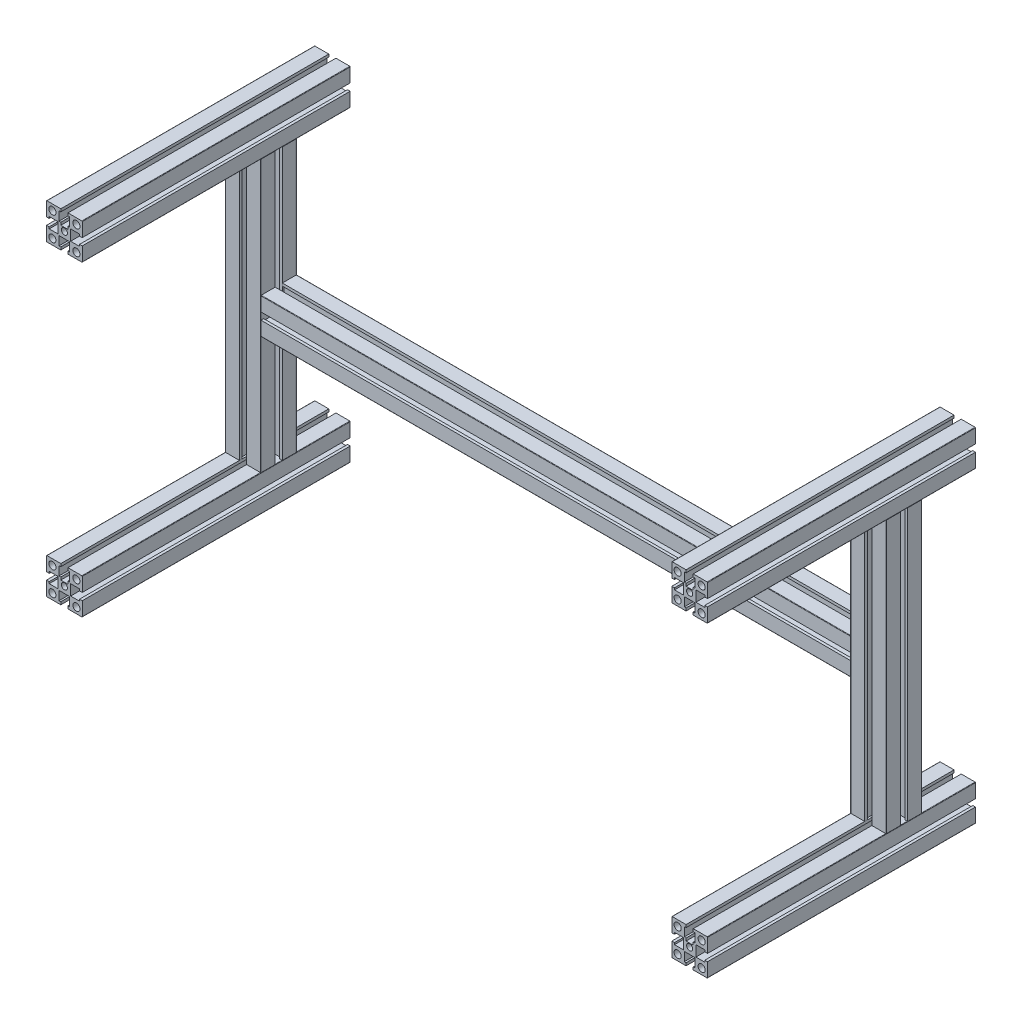
from build123d import *

# Parameters (mm, degrees)
SKETCH1_R                    = 3.4
SKETCH1_R_2                  = 4
F_40_X_40GF_X_R0_5_1_DEPTH   = 300
SKETCH1_ON_SEGMENT_2_R       = 3.4
SKETCH1_ON_SEGMENT_2_R_2     = 4
F_40_X_40GF_X_R0_5_1_2_DEPTH = 300
SKETCH1_ON_SEGMENT_3_R       = 3.4
SKETCH1_ON_SEGMENT_3_R_2     = 4
F_40_X_40GF_X_R0_5_1_3_DEPTH = 300
SKETCH1_ON_SEGMENT_4_R       = 3.4
SKETCH1_ON_SEGMENT_4_R_2     = 4
F_40_X_40GF_X_R0_5_1_4_DEPTH = 300
SKETCH1_ON_SEGMENT_5_R       = 3.4
SKETCH1_ON_SEGMENT_5_R_2     = 4
F_40_X_40GF_X_R0_5_1_5_DEPTH = 346
SKETCH1_ON_SEGMENT_6_R       = 3.4
SKETCH1_ON_SEGMENT_6_R_2     = 4
F_40_X_40GF_X_R0_5_1_6_DEPTH = 346
SKETCH1_ON_SEGMENT_7_R       = 3.4
SKETCH1_ON_SEGMENT_7_R_2     = 4
F_40_X_40GF_X_R0_5_1_7_DEPTH = 702


with BuildPart() as part:
    # Sketch1 → 工业铝型材 40 X 40GF X R0.5(1) (new body)
    with BuildSketch(Plane(origin=(-350, -172, 0), x_dir=(1, 0, 0), z_dir=(0, 0, 1))):
        with BuildLine():
            Line((-19.5, 20), (-4, 20))
            Line((-4, 20), (-4, 17))
            Line((-4, 17), (-6, 17))
            Line((-6, 17), (-6, 7))
            Line((-6, 7), (-4, 7))
            Line((-4, 7), (-4, 4))
            Line((-4, 4), (4, 4))
            Line((4, 4), (4, 7))
            Line((4, 7), (6, 7))
            Line((6, 7), (6, 17))
            Line((6, 17), (4, 17))
            Line((4, 17), (4, 20))
            Line((4, 20), (19.5, 20))
            ThreePointArc((19.5, 20), (19.853553391, 19.853553391), (20, 19.5))
            Line((20, 19.5), (20, 4))
            Line((20, 4), (17, 4))
            Line((17, 4), (17, 6))
            Line((17, 6), (7, 6))
            Line((7, 6), (7, -6))
            Line((7, -6), (17, -6))
            Line((17, -6), (17, -4))
            Line((17, -4), (20, -4))
            Line((20, -4), (20, -19.5))
            ThreePointArc((20, -19.5), (19.853553391, -19.853553391), (19.5, -20))
            Line((19.5, -20), (4, -20))
            Line((4, -20), (4, -17))
            Line((4, -17), (6, -17))
            Line((6, -17), (6, -7))
            Line((6, -7), (-6, -7))
            Line((-6, -7), (-6, -17))
            Line((-6, -17), (-4, -17))
            Line((-4, -17), (-4, -20))
            Line((-4, -20), (-19.5, -20))
            ThreePointArc((-19.5, -20), (-19.853553391, -19.853553391), (-20, -19.5))
            Line((-20, -19.5), (-20, -4))
            Line((-20, -4), (-17, -4))
            Line((-17, -4), (-17, -6))
            Line((-17, -6), (-7, -6))
            Line((-7, -6), (-7, 6))
            Line((-7, 6), (-17, 6))
            Line((-17, 6), (-17, 4))
            Line((-17, 4), (-20, 4))
            Line((-20, 4), (-20, 19.5))
            ThreePointArc((-20, 19.5), (-19.853553391, 19.853553391), (-19.5, 20))
        make_face()
        Circle(SKETCH1_R, mode=Mode.SUBTRACT)
        with Locations((-13.435028843, 13.435028843)):
            Circle(SKETCH1_R_2, mode=Mode.SUBTRACT)
        with Locations((13.435028843, 13.435028843)):
            Circle(SKETCH1_R_2, mode=Mode.SUBTRACT)
        with Locations((13.435028843, -13.435028843)):
            Circle(SKETCH1_R_2, mode=Mode.SUBTRACT)
        with Locations((-13.435028843, -13.435028843)):
            Circle(SKETCH1_R_2, mode=Mode.SUBTRACT)
    extrude(amount=F_40_X_40GF_X_R0_5_1_DEPTH)


with BuildPart() as body_2:
    # Sketch1 on segment 2 (carried to segment 2) → 40 X 40GF X R0.5_1 2 (new body)
    with BuildSketch(Plane(origin=(350, -172, 0), x_dir=(1, 0, 0), z_dir=(0, 0, 1))):
        with BuildLine():
            Line((-19.5, 20), (-4, 20))
            Line((-4, 20), (-4, 17))
            Line((-4, 17), (-6, 17))
            Line((-6, 17), (-6, 7))
            Line((-6, 7), (-4, 7))
            Line((-4, 7), (-4, 4))
            Line((-4, 4), (4, 4))
            Line((4, 4), (4, 7))
            Line((4, 7), (6, 7))
            Line((6, 7), (6, 17))
            Line((6, 17), (4, 17))
            Line((4, 17), (4, 20))
            Line((4, 20), (19.5, 20))
            ThreePointArc((19.5, 20), (19.853553391, 19.853553391), (20, 19.5))
            Line((20, 19.5), (20, 4))
            Line((20, 4), (17, 4))
            Line((17, 4), (17, 6))
            Line((17, 6), (7, 6))
            Line((7, 6), (7, -6))
            Line((7, -6), (17, -6))
            Line((17, -6), (17, -4))
            Line((17, -4), (20, -4))
            Line((20, -4), (20, -19.5))
            ThreePointArc((20, -19.5), (19.853553391, -19.853553391), (19.5, -20))
            Line((19.5, -20), (4, -20))
            Line((4, -20), (4, -17))
            Line((4, -17), (6, -17))
            Line((6, -17), (6, -7))
            Line((6, -7), (-6, -7))
            Line((-6, -7), (-6, -17))
            Line((-6, -17), (-4, -17))
            Line((-4, -17), (-4, -20))
            Line((-4, -20), (-19.5, -20))
            ThreePointArc((-19.5, -20), (-19.853553391, -19.853553391), (-20, -19.5))
            Line((-20, -19.5), (-20, -4))
            Line((-20, -4), (-17, -4))
            Line((-17, -4), (-17, -6))
            Line((-17, -6), (-7, -6))
            Line((-7, -6), (-7, 6))
            Line((-7, 6), (-17, 6))
            Line((-17, 6), (-17, 4))
            Line((-17, 4), (-20, 4))
            Line((-20, 4), (-20, 19.5))
            ThreePointArc((-20, 19.5), (-19.853553391, 19.853553391), (-19.5, 20))
        make_face()
        Circle(SKETCH1_ON_SEGMENT_2_R, mode=Mode.SUBTRACT)
        with Locations((-13.435028843, 13.435028843)):
            Circle(SKETCH1_ON_SEGMENT_2_R_2, mode=Mode.SUBTRACT)
        with Locations((13.435028843, 13.435028843)):
            Circle(SKETCH1_ON_SEGMENT_2_R_2, mode=Mode.SUBTRACT)
        with Locations((13.435028843, -13.435028843)):
            Circle(SKETCH1_ON_SEGMENT_2_R_2, mode=Mode.SUBTRACT)
        with Locations((-13.435028843, -13.435028843)):
            Circle(SKETCH1_ON_SEGMENT_2_R_2, mode=Mode.SUBTRACT)
    extrude(amount=F_40_X_40GF_X_R0_5_1_2_DEPTH)


with BuildPart() as body_3:
    # Sketch1 on segment 3 (carried to segment 3) → 40 X 40GF X R0.5_1 3 (new body)
    with BuildSketch(Plane(origin=(350, 172, 0), x_dir=(1, 0, 0), z_dir=(0, 0, 1))):
        with BuildLine():
            Line((-19.5, 20), (-4, 20))
            Line((-4, 20), (-4, 17))
            Line((-4, 17), (-6, 17))
            Line((-6, 17), (-6, 7))
            Line((-6, 7), (-4, 7))
            Line((-4, 7), (-4, 4))
            Line((-4, 4), (4, 4))
            Line((4, 4), (4, 7))
            Line((4, 7), (6, 7))
            Line((6, 7), (6, 17))
            Line((6, 17), (4, 17))
            Line((4, 17), (4, 20))
            Line((4, 20), (19.5, 20))
            ThreePointArc((19.5, 20), (19.853553391, 19.853553391), (20, 19.5))
            Line((20, 19.5), (20, 4))
            Line((20, 4), (17, 4))
            Line((17, 4), (17, 6))
            Line((17, 6), (7, 6))
            Line((7, 6), (7, -6))
            Line((7, -6), (17, -6))
            Line((17, -6), (17, -4))
            Line((17, -4), (20, -4))
            Line((20, -4), (20, -19.5))
            ThreePointArc((20, -19.5), (19.853553391, -19.853553391), (19.5, -20))
            Line((19.5, -20), (4, -20))
            Line((4, -20), (4, -17))
            Line((4, -17), (6, -17))
            Line((6, -17), (6, -7))
            Line((6, -7), (-6, -7))
            Line((-6, -7), (-6, -17))
            Line((-6, -17), (-4, -17))
            Line((-4, -17), (-4, -20))
            Line((-4, -20), (-19.5, -20))
            ThreePointArc((-19.5, -20), (-19.853553391, -19.853553391), (-20, -19.5))
            Line((-20, -19.5), (-20, -4))
            Line((-20, -4), (-17, -4))
            Line((-17, -4), (-17, -6))
            Line((-17, -6), (-7, -6))
            Line((-7, -6), (-7, 6))
            Line((-7, 6), (-17, 6))
            Line((-17, 6), (-17, 4))
            Line((-17, 4), (-20, 4))
            Line((-20, 4), (-20, 19.5))
            ThreePointArc((-20, 19.5), (-19.853553391, 19.853553391), (-19.5, 20))
        make_face()
        Circle(SKETCH1_ON_SEGMENT_3_R, mode=Mode.SUBTRACT)
        with Locations((-13.435028843, 13.435028843)):
            Circle(SKETCH1_ON_SEGMENT_3_R_2, mode=Mode.SUBTRACT)
        with Locations((13.435028843, 13.435028843)):
            Circle(SKETCH1_ON_SEGMENT_3_R_2, mode=Mode.SUBTRACT)
        with Locations((13.435028843, -13.435028843)):
            Circle(SKETCH1_ON_SEGMENT_3_R_2, mode=Mode.SUBTRACT)
        with Locations((-13.435028843, -13.435028843)):
            Circle(SKETCH1_ON_SEGMENT_3_R_2, mode=Mode.SUBTRACT)
    extrude(amount=F_40_X_40GF_X_R0_5_1_3_DEPTH)


with BuildPart() as body_4:
    # Sketch1 on segment 4 (carried to segment 4) → 40 X 40GF X R0.5_1 4 (new body)
    with BuildSketch(Plane(origin=(-350, 172, 0), x_dir=(1, 0, 0), z_dir=(0, 0, 1))):
        with BuildLine():
            Line((-19.5, 20), (-4, 20))
            Line((-4, 20), (-4, 17))
            Line((-4, 17), (-6, 17))
            Line((-6, 17), (-6, 7))
            Line((-6, 7), (-4, 7))
            Line((-4, 7), (-4, 4))
            Line((-4, 4), (4, 4))
            Line((4, 4), (4, 7))
            Line((4, 7), (6, 7))
            Line((6, 7), (6, 17))
            Line((6, 17), (4, 17))
            Line((4, 17), (4, 20))
            Line((4, 20), (19.5, 20))
            ThreePointArc((19.5, 20), (19.853553391, 19.853553391), (20, 19.5))
            Line((20, 19.5), (20, 4))
            Line((20, 4), (17, 4))
            Line((17, 4), (17, 6))
            Line((17, 6), (7, 6))
            Line((7, 6), (7, -6))
            Line((7, -6), (17, -6))
            Line((17, -6), (17, -4))
            Line((17, -4), (20, -4))
            Line((20, -4), (20, -19.5))
            ThreePointArc((20, -19.5), (19.853553391, -19.853553391), (19.5, -20))
            Line((19.5, -20), (4, -20))
            Line((4, -20), (4, -17))
            Line((4, -17), (6, -17))
            Line((6, -17), (6, -7))
            Line((6, -7), (-6, -7))
            Line((-6, -7), (-6, -17))
            Line((-6, -17), (-4, -17))
            Line((-4, -17), (-4, -20))
            Line((-4, -20), (-19.5, -20))
            ThreePointArc((-19.5, -20), (-19.853553391, -19.853553391), (-20, -19.5))
            Line((-20, -19.5), (-20, -4))
            Line((-20, -4), (-17, -4))
            Line((-17, -4), (-17, -6))
            Line((-17, -6), (-7, -6))
            Line((-7, -6), (-7, 6))
            Line((-7, 6), (-17, 6))
            Line((-17, 6), (-17, 4))
            Line((-17, 4), (-20, 4))
            Line((-20, 4), (-20, 19.5))
            ThreePointArc((-20, 19.5), (-19.853553391, 19.853553391), (-19.5, 20))
        make_face()
        Circle(SKETCH1_ON_SEGMENT_4_R, mode=Mode.SUBTRACT)
        with Locations((-13.435028843, 13.435028843)):
            Circle(SKETCH1_ON_SEGMENT_4_R_2, mode=Mode.SUBTRACT)
        with Locations((13.435028843, 13.435028843)):
            Circle(SKETCH1_ON_SEGMENT_4_R_2, mode=Mode.SUBTRACT)
        with Locations((13.435028843, -13.435028843)):
            Circle(SKETCH1_ON_SEGMENT_4_R_2, mode=Mode.SUBTRACT)
        with Locations((-13.435028843, -13.435028843)):
            Circle(SKETCH1_ON_SEGMENT_4_R_2, mode=Mode.SUBTRACT)
    extrude(amount=F_40_X_40GF_X_R0_5_1_4_DEPTH)


with BuildPart() as body_5:
    # Sketch1 on segment 5 (carried to segment 5) → 40 X 40GF X R0.5_1 5 (new body)
    with BuildSketch(Plane(origin=(-350, -173, 80), x_dir=(1, 0, 0), z_dir=(0, 1, 0))):
        with BuildLine():
            Line((-19.5, 20), (-4, 20))
            Line((-4, 20), (-4, 17))
            Line((-4, 17), (-6, 17))
            Line((-6, 17), (-6, 7))
            Line((-6, 7), (-4, 7))
            Line((-4, 7), (-4, 4))
            Line((-4, 4), (4, 4))
            Line((4, 4), (4, 7))
            Line((4, 7), (6, 7))
            Line((6, 7), (6, 17))
            Line((6, 17), (4, 17))
            Line((4, 17), (4, 20))
            Line((4, 20), (19.5, 20))
            ThreePointArc((19.5, 20), (19.853553391, 19.853553391), (20, 19.5))
            Line((20, 19.5), (20, 4))
            Line((20, 4), (17, 4))
            Line((17, 4), (17, 6))
            Line((17, 6), (7, 6))
            Line((7, 6), (7, -6))
            Line((7, -6), (17, -6))
            Line((17, -6), (17, -4))
            Line((17, -4), (20, -4))
            Line((20, -4), (20, -19.5))
            ThreePointArc((20, -19.5), (19.853553391, -19.853553391), (19.5, -20))
            Line((19.5, -20), (4, -20))
            Line((4, -20), (4, -17))
            Line((4, -17), (6, -17))
            Line((6, -17), (6, -7))
            Line((6, -7), (-6, -7))
            Line((-6, -7), (-6, -17))
            Line((-6, -17), (-4, -17))
            Line((-4, -17), (-4, -20))
            Line((-4, -20), (-19.5, -20))
            ThreePointArc((-19.5, -20), (-19.853553391, -19.853553391), (-20, -19.5))
            Line((-20, -19.5), (-20, -4))
            Line((-20, -4), (-17, -4))
            Line((-17, -4), (-17, -6))
            Line((-17, -6), (-7, -6))
            Line((-7, -6), (-7, 6))
            Line((-7, 6), (-17, 6))
            Line((-17, 6), (-17, 4))
            Line((-17, 4), (-20, 4))
            Line((-20, 4), (-20, 19.5))
            ThreePointArc((-20, 19.5), (-19.853553391, 19.853553391), (-19.5, 20))
        make_face()
        Circle(SKETCH1_ON_SEGMENT_5_R, mode=Mode.SUBTRACT)
        with Locations((-13.435028843, 13.435028843)):
            Circle(SKETCH1_ON_SEGMENT_5_R_2, mode=Mode.SUBTRACT)
        with Locations((13.435028843, 13.435028843)):
            Circle(SKETCH1_ON_SEGMENT_5_R_2, mode=Mode.SUBTRACT)
        with Locations((13.435028843, -13.435028843)):
            Circle(SKETCH1_ON_SEGMENT_5_R_2, mode=Mode.SUBTRACT)
        with Locations((-13.435028843, -13.435028843)):
            Circle(SKETCH1_ON_SEGMENT_5_R_2, mode=Mode.SUBTRACT)
    extrude(amount=F_40_X_40GF_X_R0_5_1_5_DEPTH)

    # 40 X 40GF X R0.5_1 5 end butt 1
    split(bisect_by=Plane(origin=(-350, -152, 80), x_dir=(-1, 0, 0), z_dir=(0, 1, 0)), keep=Keep.TOP)

    # 40 X 40GF X R0.5_1 5 end butt 2
    split(bisect_by=Plane(origin=(-350, 152, 80), x_dir=(1, 0, 0), z_dir=(0, -1, 0)), keep=Keep.TOP)


with BuildPart() as body_6:
    # Sketch1 on segment 6 (carried to segment 6) → 40 X 40GF X R0.5_1 6 (new body)
    with BuildSketch(Plane(origin=(350, -173, 80), x_dir=(1, 0, 0), z_dir=(0, 1, 0))):
        with BuildLine():
            Line((-19.5, 20), (-4, 20))
            Line((-4, 20), (-4, 17))
            Line((-4, 17), (-6, 17))
            Line((-6, 17), (-6, 7))
            Line((-6, 7), (-4, 7))
            Line((-4, 7), (-4, 4))
            Line((-4, 4), (4, 4))
            Line((4, 4), (4, 7))
            Line((4, 7), (6, 7))
            Line((6, 7), (6, 17))
            Line((6, 17), (4, 17))
            Line((4, 17), (4, 20))
            Line((4, 20), (19.5, 20))
            ThreePointArc((19.5, 20), (19.853553391, 19.853553391), (20, 19.5))
            Line((20, 19.5), (20, 4))
            Line((20, 4), (17, 4))
            Line((17, 4), (17, 6))
            Line((17, 6), (7, 6))
            Line((7, 6), (7, -6))
            Line((7, -6), (17, -6))
            Line((17, -6), (17, -4))
            Line((17, -4), (20, -4))
            Line((20, -4), (20, -19.5))
            ThreePointArc((20, -19.5), (19.853553391, -19.853553391), (19.5, -20))
            Line((19.5, -20), (4, -20))
            Line((4, -20), (4, -17))
            Line((4, -17), (6, -17))
            Line((6, -17), (6, -7))
            Line((6, -7), (-6, -7))
            Line((-6, -7), (-6, -17))
            Line((-6, -17), (-4, -17))
            Line((-4, -17), (-4, -20))
            Line((-4, -20), (-19.5, -20))
            ThreePointArc((-19.5, -20), (-19.853553391, -19.853553391), (-20, -19.5))
            Line((-20, -19.5), (-20, -4))
            Line((-20, -4), (-17, -4))
            Line((-17, -4), (-17, -6))
            Line((-17, -6), (-7, -6))
            Line((-7, -6), (-7, 6))
            Line((-7, 6), (-17, 6))
            Line((-17, 6), (-17, 4))
            Line((-17, 4), (-20, 4))
            Line((-20, 4), (-20, 19.5))
            ThreePointArc((-20, 19.5), (-19.853553391, 19.853553391), (-19.5, 20))
        make_face()
        Circle(SKETCH1_ON_SEGMENT_6_R, mode=Mode.SUBTRACT)
        with Locations((-13.435028843, 13.435028843)):
            Circle(SKETCH1_ON_SEGMENT_6_R_2, mode=Mode.SUBTRACT)
        with Locations((13.435028843, 13.435028843)):
            Circle(SKETCH1_ON_SEGMENT_6_R_2, mode=Mode.SUBTRACT)
        with Locations((13.435028843, -13.435028843)):
            Circle(SKETCH1_ON_SEGMENT_6_R_2, mode=Mode.SUBTRACT)
        with Locations((-13.435028843, -13.435028843)):
            Circle(SKETCH1_ON_SEGMENT_6_R_2, mode=Mode.SUBTRACT)
    extrude(amount=F_40_X_40GF_X_R0_5_1_6_DEPTH)

    # 40 X 40GF X R0.5_1 6 end butt 1
    split(bisect_by=Plane(origin=(350, -152, 80), x_dir=(-1, 0, 0), z_dir=(0, 1, 0)), keep=Keep.TOP)

    # 40 X 40GF X R0.5_1 6 end butt 2
    split(bisect_by=Plane(origin=(350, 152, 80), x_dir=(1, 0, 0), z_dir=(0, -1, 0)), keep=Keep.TOP)


with BuildPart() as body_7:
    # Sketch1 on segment 7 (carried to segment 7) → 40 X 40GF X R0.5_1 7 (new body)
    with BuildSketch(Plane(origin=(-351, 0, 80), x_dir=(0, 0, -1), z_dir=(1, 0, 0))):
        with BuildLine():
            Line((-19.5, 20), (-4, 20))
            Line((-4, 20), (-4, 17))
            Line((-4, 17), (-6, 17))
            Line((-6, 17), (-6, 7))
            Line((-6, 7), (-4, 7))
            Line((-4, 7), (-4, 4))
            Line((-4, 4), (4, 4))
            Line((4, 4), (4, 7))
            Line((4, 7), (6, 7))
            Line((6, 7), (6, 17))
            Line((6, 17), (4, 17))
            Line((4, 17), (4, 20))
            Line((4, 20), (19.5, 20))
            ThreePointArc((19.5, 20), (19.853553391, 19.853553391), (20, 19.5))
            Line((20, 19.5), (20, 4))
            Line((20, 4), (17, 4))
            Line((17, 4), (17, 6))
            Line((17, 6), (7, 6))
            Line((7, 6), (7, -6))
            Line((7, -6), (17, -6))
            Line((17, -6), (17, -4))
            Line((17, -4), (20, -4))
            Line((20, -4), (20, -19.5))
            ThreePointArc((20, -19.5), (19.853553391, -19.853553391), (19.5, -20))
            Line((19.5, -20), (4, -20))
            Line((4, -20), (4, -17))
            Line((4, -17), (6, -17))
            Line((6, -17), (6, -7))
            Line((6, -7), (-6, -7))
            Line((-6, -7), (-6, -17))
            Line((-6, -17), (-4, -17))
            Line((-4, -17), (-4, -20))
            Line((-4, -20), (-19.5, -20))
            ThreePointArc((-19.5, -20), (-19.853553391, -19.853553391), (-20, -19.5))
            Line((-20, -19.5), (-20, -4))
            Line((-20, -4), (-17, -4))
            Line((-17, -4), (-17, -6))
            Line((-17, -6), (-7, -6))
            Line((-7, -6), (-7, 6))
            Line((-7, 6), (-17, 6))
            Line((-17, 6), (-17, 4))
            Line((-17, 4), (-20, 4))
            Line((-20, 4), (-20, 19.5))
            ThreePointArc((-20, 19.5), (-19.853553391, 19.853553391), (-19.5, 20))
        make_face()
        Circle(SKETCH1_ON_SEGMENT_7_R, mode=Mode.SUBTRACT)
        with Locations((-13.435028843, 13.435028843)):
            Circle(SKETCH1_ON_SEGMENT_7_R_2, mode=Mode.SUBTRACT)
        with Locations((13.435028843, 13.435028843)):
            Circle(SKETCH1_ON_SEGMENT_7_R_2, mode=Mode.SUBTRACT)
        with Locations((13.435028843, -13.435028843)):
            Circle(SKETCH1_ON_SEGMENT_7_R_2, mode=Mode.SUBTRACT)
        with Locations((-13.435028843, -13.435028843)):
            Circle(SKETCH1_ON_SEGMENT_7_R_2, mode=Mode.SUBTRACT)
    extrude(amount=F_40_X_40GF_X_R0_5_1_7_DEPTH)

    # 40 X 40GF X R0.5_1 7 end butt 1
    split(bisect_by=Plane(origin=(-330, 0, 80), x_dir=(0, 1, 0), z_dir=(1, 0, 0)), keep=Keep.TOP)

    # 40 X 40GF X R0.5_1 7 end butt 2
    split(bisect_by=Plane(origin=(330, 0, 80), x_dir=(0, -1, 0), z_dir=(-1, 0, 0)), keep=Keep.TOP)


solid = Compound([part.part, body_2.part, body_3.part, body_4.part, body_5.part, body_6.part, body_7.part])
